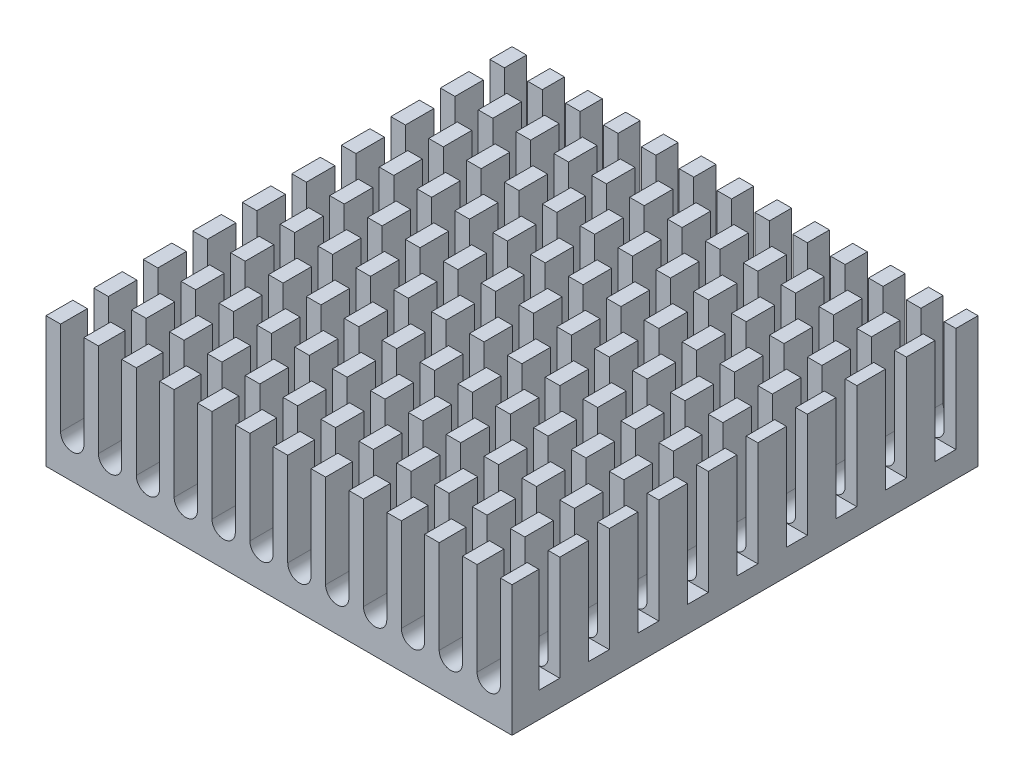
from build123d import *

# Parameters (mm, degrees)
SKETCH1_W           = 40
SKETCH1_H           = 40
BOSS_EXTRUDE1_DEPTH = 11.2
CUT_EXTRUDE1_DEPTH  = 47.10249451
LPATTERN1_COUNT     = 12
LPATTERN1_PITCH     = 3.25
SKETCH3_W           = 1.8
SKETCH3_H           = 9
CUT_EXTRUDE2_DEPTH  = 47.10249451
LPATTERN2_COUNT     = 9
LPATTERN2_PITCH     = 4.25


with BuildPart() as part:
    # Sketch1 → Boss-Extrude1 (new body)
    with BuildSketch(Plane(origin=(0, 0, 0), x_dir=(1, 0, 0), z_dir=(0, 1, 0))):
        Rectangle(SKETCH1_W, SKETCH1_H)
    extrude(amount=BOSS_EXTRUDE1_DEPTH)

    # Sketch2 → Cut-Extrude1 (cut, through all)
    with BuildSketch(Plane.XY.offset(20)):
        with BuildLine():
            Line((17, 3.2), (17, 11.2))
            Line((17, 11.2), (19, 11.2))
            Line((19, 11.2), (19, 3.2))
            ThreePointArc((19, 3.2), (18, 2.2), (17, 3.2))
        make_face()
    cut_extrude1 = extrude(amount=-CUT_EXTRUDE1_DEPTH, mode=Mode.SUBTRACT)

    # LPattern1: Cut-Extrude1 ×12
    with Locations(*[(-i * LPATTERN1_PITCH, 0, 0) for i in range(1, LPATTERN1_COUNT)]):
        add(cut_extrude1, mode=Mode.SUBTRACT)

    # Sketch3 → Cut-Extrude2 (cut, through all)
    with BuildSketch(Plane(origin=(20, 0, 0), x_dir=(0, 0, -1), z_dir=(1, 0, 0))):
        with Locations((-16.8, 6.7)):
            Rectangle(SKETCH3_W, SKETCH3_H)
    cut_extrude2 = extrude(amount=-CUT_EXTRUDE2_DEPTH, mode=Mode.SUBTRACT)

    # LPattern2: Cut-Extrude2 ×9
    with Locations(*[(0, 0, -i * LPATTERN2_PITCH) for i in range(1, LPATTERN2_COUNT)]):
        add(cut_extrude2, mode=Mode.SUBTRACT)


solid = part.part
